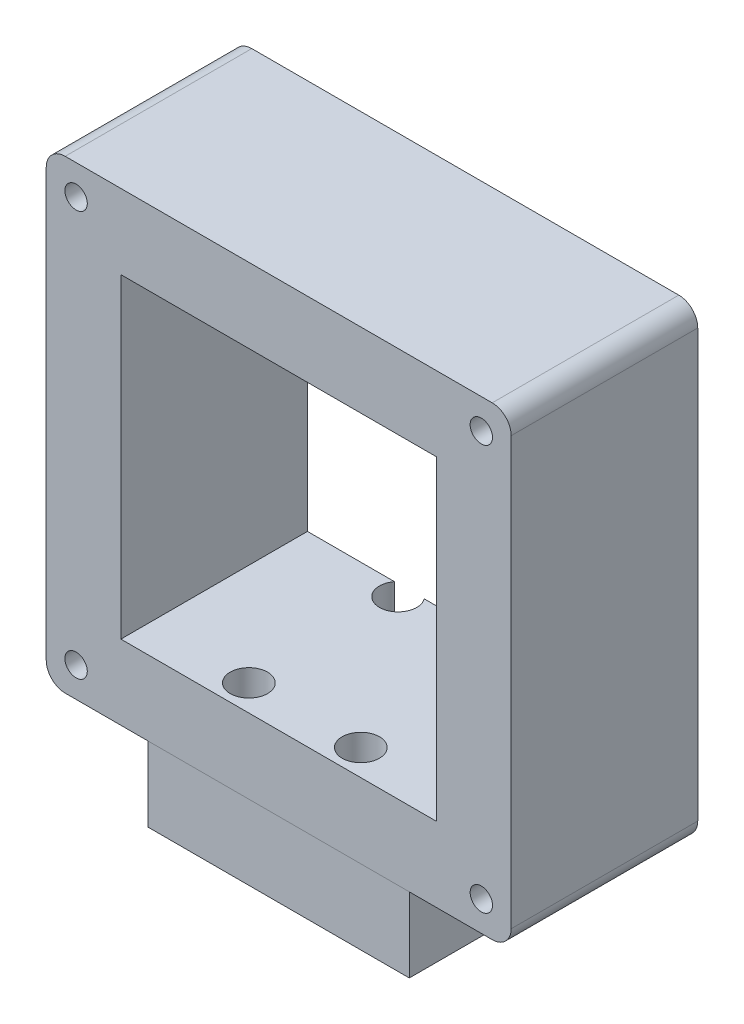
from build123d import *

# Parameters (mm, degrees)
SKETCH1_W           = 35
SKETCH1_H           = 27
SKETCH1_R           = 1.500000048
BOSS_EXTRUDE1_DEPTH = 5
SKETCH2_W           = 62.3
SKETCH2_H           = 62.3
SKETCH2_W_2         = 42.3
SKETCH2_H_2         = 42.3
BOSS_EXTRUDE2_DEPTH = 25
SKETCH3_R           = 2.5
CUT_EXTRUDE2_DEPTH  = 10
SKETCH4_R           = 1.5
CUT_EXTRUDE3_DEPTH  = 5
FILLET1_R           = 2.54


with BuildPart() as part:
    # Sketch1 → Boss-Extrude1 (new, symmetric)
    with BuildSketch(Plane(origin=(0, 0, 0), x_dir=(1, 0, 0), z_dir=(0, 1, 0))):
        Rectangle(SKETCH1_W, SKETCH1_H)
        with Locations(Location((-7.499999986, 9.999999939, 0), (0, 0, 270))):
            Circle(SKETCH1_R, mode=Mode.SUBTRACT)
        with Locations(Location((7.499999986, 9.999999939, 0), (0, 0, 270))):
            Circle(SKETCH1_R, mode=Mode.SUBTRACT)
        with Locations(Location((7.499999986, -9.999999939, 0), (0, 0, 270))):
            Circle(SKETCH1_R, mode=Mode.SUBTRACT)
        with Locations(Location((-7.499999986, -9.999999939, 0), (0, 0, 270))):
            Circle(SKETCH1_R, mode=Mode.SUBTRACT)
    extrude(amount=BOSS_EXTRUDE1_DEPTH, both=True)


with BuildPart() as body_2:
    # Sketch2 → Boss-Extrude2 (new body)
    with BuildSketch(Plane.XY.offset(13.5)):
        with Locations((0, 36.15)):
            Rectangle(SKETCH2_W, SKETCH2_H)
        with Locations((0, 36.15)):
            Rectangle(SKETCH2_W_2, SKETCH2_H_2, mode=Mode.SUBTRACT)
    extrude(amount=-BOSS_EXTRUDE2_DEPTH)

    # Sketch3 → Cut-Extrude2 (cut)
    with BuildSketch(Plane.XZ.offset(-5)):
        with Locations(Location((-7.499999986, 9.999999939, 0), (0, 0, 270))):
            Circle(SKETCH3_R)
        with Locations(Location((7.499999986, 9.999999939, 0), (0, 0, 270))):
            Circle(SKETCH3_R)
        with Locations((7.499999986, -9.999999939)):
            Circle(SKETCH3_R)
        with Locations((-7.499999986, -9.999999939)):
            Circle(SKETCH3_R)
    extrude(amount=-CUT_EXTRUDE2_DEPTH, mode=Mode.SUBTRACT)

    # Sketch4 → Cut-Extrude3 (cut)
    with BuildSketch(Plane.XY.offset(13.5)):
        with Locations((-27.15, 63.3)):
            Circle(SKETCH4_R)
        with Locations((27.15, 63.3)):
            Circle(SKETCH4_R)
        with Locations((27.15, 9)):
            Circle(SKETCH4_R)
        with Locations((-27.15, 9)):
            Circle(SKETCH4_R)
    extrude(amount=-CUT_EXTRUDE3_DEPTH, mode=Mode.SUBTRACT)

    # Fillet1
    fillet1_edges = [body_2.edges().sort_by_distance(p)[0] for p in [
        (31.15, 5, 1),
        (-31.15, 5, 1),
        (-31.15, 67.3, 1),
        (31.15, 67.3, 1),
    ]]
    fillet(fillet1_edges, radius=FILLET1_R)


solid = Compound([part.part, body_2.part])
